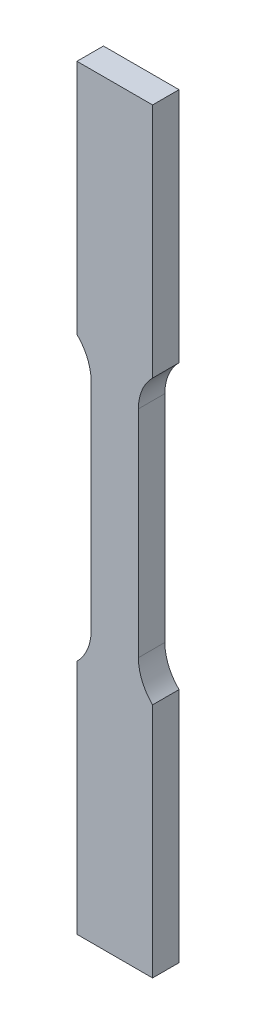
from build123d import *

# Parameters (mm, degrees)
SKETCH1_W           = 19.999999878
SKETCH1_H           = 200.00000005
BOSS_EXTRUDE1_DEPTH = 3.499999985
CUT_EXTRUDE1_DEPTH  = 7.112


with BuildPart() as part:
    # Sketch1 → Boss-Extrude1 (new, symmetric)
    with BuildSketch(Plane.XY):
        Rectangle(SKETCH1_W, SKETCH1_H)
    extrude(amount=BOSS_EXTRUDE1_DEPTH, both=True)

    # Sketch2 → Cut-Extrude1 (cut)
    with BuildSketch(Plane.XY.offset(3.499999985)):
        with BuildLine():
            ThreePointArc((-9.999999939, 19.57321454), (-7.225569373, 23.658770866), (-6.249999946, 28.500000023))
            ThreePointArc((-6.249999946, 28.500000023), (-7.225569373, 33.34122918), (-9.999999939, 37.426785506))
            Line((-9.999999939, 37.426785506), (-9.999999939, 19.57321454))
        make_face()
        with BuildLine():
            ThreePointArc((-9.999999939, 37.426785506), (-31.24999973, 28.500000023), (-9.999999939, 19.57321454))
            Line((-9.999999939, 19.57321454), (-9.999999939, 37.426785506))
        make_face()
        with BuildLine():
            ThreePointArc((9.999999939, 37.426785506), (7.225569373, 33.34122918), (6.249999946, 28.500000023))
            ThreePointArc((6.249999946, 28.500000023), (7.225569373, 23.658770866), (9.999999939, 19.57321454))
            Line((9.999999939, 19.57321454), (9.999999939, 37.426785506))
        make_face()
        with BuildLine():
            Line((9.999999939, 37.426785506), (9.999999939, 19.57321454))
            ThreePointArc((9.999999939, 19.57321454), (23.591228995, 16.975569558), (31.24999973, 28.500000023))
            ThreePointArc((31.24999973, 28.500000023), (23.591228995, 40.024430488), (9.999999939, 37.426785506))
        make_face()
        with BuildLine():
            Line((6.249999946, 28.500000023), (6.249999946, -28.500000023))
            ThreePointArc((6.249999946, -28.500000023), (7.225569373, -23.658770866), (9.999999939, -19.57321454))
            Line((9.999999939, -19.57321454), (9.999999939, 19.57321454))
            ThreePointArc((9.999999939, 19.57321454), (7.225569373, 23.658770866), (6.249999946, 28.500000023))
        make_face()
        with BuildLine():
            ThreePointArc((-9.999999939, -19.57321454), (-7.225569373, -23.658770866), (-6.249999946, -28.500000023))
            Line((-6.249999946, -28.500000023), (-6.249999946, 28.500000023))
            ThreePointArc((-6.249999946, 28.500000023), (-7.225569373, 23.658770866), (-9.999999939, 19.57321454))
            Line((-9.999999939, 19.57321454), (-9.999999939, -19.57321454))
        make_face()
        with BuildLine():
            ThreePointArc((-9.999999939, -37.426785506), (-7.225569373, -33.34122918), (-6.249999946, -28.500000023))
            ThreePointArc((-6.249999946, -28.500000023), (-7.225569373, -23.658770866), (-9.999999939, -19.57321454))
            Line((-9.999999939, -19.57321454), (-9.999999939, -37.426785506))
        make_face()
        with BuildLine():
            Line((-9.999999939, -37.426785506), (-9.999999939, -19.57321454))
            ThreePointArc((-9.999999939, -19.57321454), (-31.24999973, -28.500000023), (-9.999999939, -37.426785506))
        make_face()
        with BuildLine():
            ThreePointArc((9.999999939, -19.57321454), (7.225569373, -23.658770866), (6.249999946, -28.500000023))
            ThreePointArc((6.249999946, -28.500000023), (7.225569373, -33.34122918), (9.999999939, -37.426785506))
            Line((9.999999939, -37.426785506), (9.999999939, -19.57321454))
        make_face()
        with BuildLine():
            ThreePointArc((31.24999973, -28.500000023), (23.591228995, -16.975569558), (9.999999939, -19.57321454))
            Line((9.999999939, -19.57321454), (9.999999939, -37.426785506))
            ThreePointArc((9.999999939, -37.426785506), (23.591228995, -40.024430488), (31.24999973, -28.500000023))
        make_face()
    extrude(amount=-CUT_EXTRUDE1_DEPTH, mode=Mode.SUBTRACT)


solid = part.part
